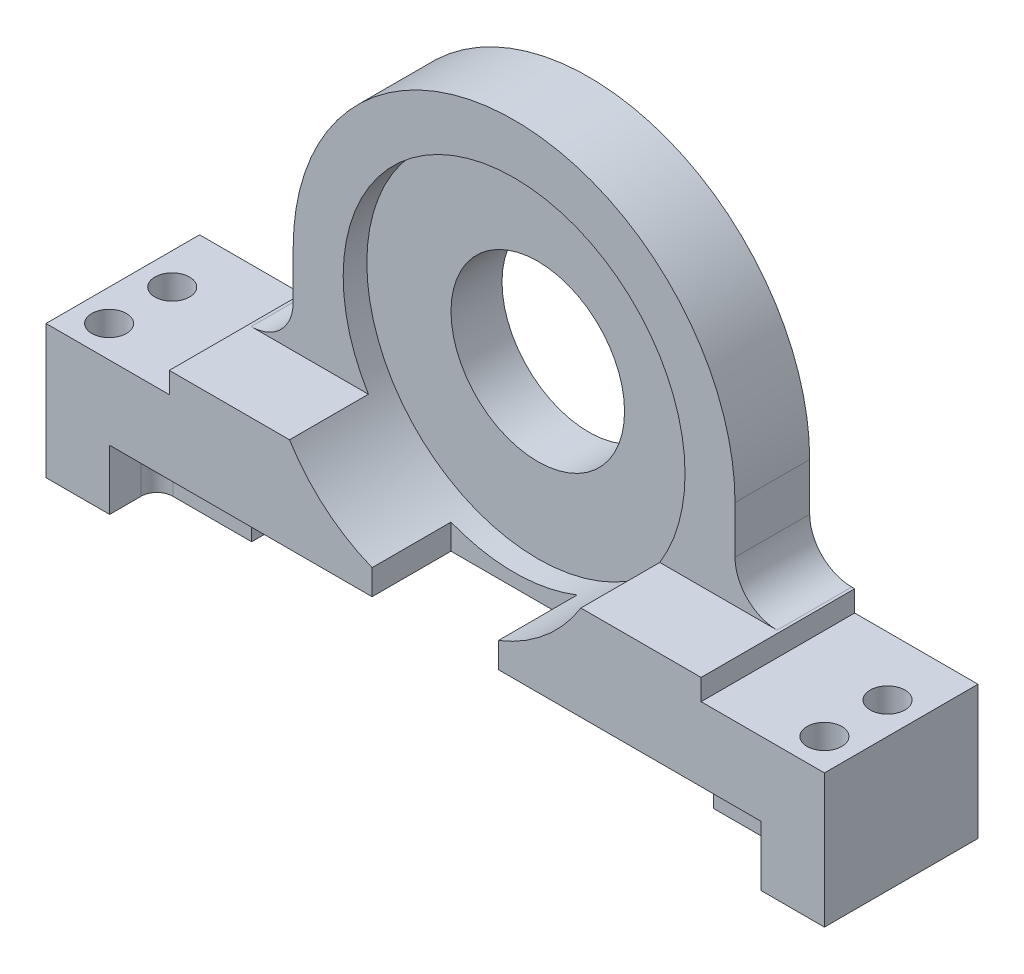
from build123d import *

# Parameters (mm, degrees)
SKETCH2_R           = 16
BOSS_EXTRUDE1_DEPTH = 12
SKETCH3_R           = 16
SKETCH3_R_2         = 8.25
BOSS_EXTRUDE2_DEPTH = 2.5
CUT_EXTRUDE4_DEPTH  = 1
CUT_EXTRUDE5_REACH  = 60.683
SKETCH9_W           = 43.9
SKETCH9_H           = 5.7
SKETCH10_R          = 1.65
CUT_EXTRUDE6_DEPTH  = 59.87817932
CUT_EXTRUDE7_START  = -7.5
CUT_EXTRUDE7_DEPTH  = 7.5
FILETE1_R           = 2
FILETE2_R           = 4
SKETCH12_W          = 9
SKETCH12_H          = 5.7
CUT_EXTRUDE8_DEPTH  = 4.5
SKETCH15_W          = 12
SKETCH15_H          = 2.667603026
CUT_EXTRUDE10_DEPTH = 7.5
SKETCH16_R          = 8.25
BOSS_EXTRUDE3_DEPTH = 2.6
FILLET2_R           = 1.5
CUT_EXTRUDE11_REACH = 61.463
SKETCH17_W          = 11.722279144
SKETCH17_H          = 2
CUT_EXTRUDE12_START = -2.25
SKETCH18_R          = 16.25
CUT_EXTRUDE12_DEPTH = 9.75


with BuildPart() as part:
    # Sketch2 → Boss-Extrude1 (new body)
    with BuildSketch(Plane.XY):
        with BuildLine():
            Line((-21, 0), (21, 0))
            Line((21, 0), (37, 0))
            Line((37, 0), (37, 14.7))
            Line((37, 14.7), (21, 14.7))
            Line((21, 14.7), (21, 23.2))
            ThreePointArc((21, 23.2), (0, 44.2), (-21, 23.2))
            Line((-21, 23.2), (-21, 14.7))
            Line((-21, 14.7), (-37, 14.7))
            Line((-37, 14.7), (-37, 0))
            Line((-37, 0), (-21, 0))
        make_face()
        with Locations((0, 23.2)):
            Circle(SKETCH2_R, mode=Mode.SUBTRACT)
    extrude(amount=BOSS_EXTRUDE1_DEPTH)

    # Sketch3 → Boss-Extrude2 (add)
    with BuildSketch(Plane.XY):
        with Locations((0, 23.2)):
            Circle(SKETCH3_R)
        with Locations((0, 23.2)):
            Circle(SKETCH3_R_2, mode=Mode.SUBTRACT)
    extrude(amount=BOSS_EXTRUDE2_DEPTH)

    # Sketch8 → Cut-Extrude4 (cut)
    with BuildSketch(Plane.XY):
        Polygon((-27.15, 0), (27.15, 0), (34.2, 0), (34.2, 7.35), (27.15, 7.35), (27.15, 10.7), (-27.15, 10.7), (-27.15, 7.35), (-34.2, 7.35), (-34.2, 0), align=None)
    extrude(amount=CUT_EXTRUDE4_DEPTH, mode=Mode.SUBTRACT)

    # Sketch9 → Cut-Extrude5 (cut, up to next)
    with BuildSketch(Plane(origin=(0, 0, 1), x_dir=(-1, 0, 0), z_dir=(0, 0, -1)), mode=Mode.PRIVATE) as cut_extrude5_sk1:
        with Locations((0, 2.85)):
            Rectangle(SKETCH9_W, SKETCH9_H)
    cut_extrude5_tool1 = extrude(cut_extrude5_sk1.sketch, amount=-CUT_EXTRUDE5_REACH, mode=Mode.PRIVATE) & part.part
    add(cut_extrude5_tool1.solids().sort_by_distance((0, 2.85, 1))[0], mode=Mode.SUBTRACT)

    # Sketch10 → Cut-Extrude6 (cut, through all)
    with BuildSketch(Plane.XZ):
        with Locations((-34, 9)):
            Circle(SKETCH10_R)
        with Locations((-34, 3)):
            Circle(SKETCH10_R)
        with Locations((34, 3)):
            Circle(SKETCH10_R)
        with Locations((34, 9)):
            Circle(SKETCH10_R)
    extrude(amount=-CUT_EXTRUDE6_DEPTH, mode=Mode.SUBTRACT)

    # Sketch11 → Cut-Extrude7 (cut)
    with BuildSketch(Plane.XY.offset(12).offset(CUT_EXTRUDE7_START)):
        with BuildLine():
            Line((21, 14.7), (21, 23.2))
            ThreePointArc((21, 23.2), (0, 44.2), (-21, 23.2))
            Line((-21, 23.2), (-21, 14.7))
            Line((-21, 14.7), (21, 14.7))
        make_face()
    extrude(amount=CUT_EXTRUDE7_DEPTH, mode=Mode.SUBTRACT)

    # Filete1
    filete1_edges = [part.edges().sort_by_distance(p)[0] for p in [
        (27.15, 10.7, 0.5),
        (-27.15, 10.7, 0.5),
    ]]
    fillet(filete1_edges, radius=FILETE1_R)

    # Filete2
    filete2_edges = [part.edges().sort_by_distance(p)[0] for p in [
        (-21, 14.7, 2.25),
        (21, 14.7, 2.25),
    ]]
    fillet(filete2_edges, radius=FILETE2_R)

    # Sketch12 → Cut-Extrude8 (cut)
    with BuildSketch(Plane.XY.offset(12)):
        with Locations((26.45, 2.85)):
            Rectangle(SKETCH12_W, SKETCH12_H)
        with Locations((-26.45, 2.85)):
            Rectangle(SKETCH12_W, SKETCH12_H)
    extrude(amount=-CUT_EXTRUDE8_DEPTH, mode=Mode.SUBTRACT)

    # Sketch15 → Cut-Extrude10 (cut)
    with BuildSketch(Plane.XY.offset(12)):
        with Locations((0, 7.033801513)):
            Rectangle(SKETCH15_W, SKETCH15_H)
    extrude(amount=-CUT_EXTRUDE10_DEPTH, mode=Mode.SUBTRACT)

    # Sketch16 → Boss-Extrude3 (add)
    with BuildSketch(Plane(origin=(0, 0, 0), x_dir=(-1, 0, 0), z_dir=(0, 0, -1))):
        with BuildLine():
            Line((-37, 14.7), (-25, 14.7))
            ThreePointArc((-25, 14.7), (-22.171572875, 15.871572875), (-21, 18.7))
            Line((-21, 18.7), (-21, 23.2))
            ThreePointArc((-21, 23.2), (0, 44.2), (21, 23.2))
            Line((21, 23.2), (21, 18.7))
            ThreePointArc((21, 18.7), (22.171572875, 15.871572875), (25, 14.7))
            Line((25, 14.7), (37, 14.7))
            Line((37, 14.7), (37, 0))
            Line((37, 0), (34.2, 0))
            Line((34.2, 0), (34.2, 7.35))
            Line((34.2, 7.35), (27.15, 7.35))
            Line((27.15, 7.35), (27.15, 8.7))
            ThreePointArc((27.15, 8.7), (26.564213562, 10.114213562), (25.15, 10.7))
            Line((25.15, 10.7), (-25.15, 10.7))
            ThreePointArc((-25.15, 10.7), (-26.564213562, 10.114213562), (-27.15, 8.7))
            Line((-27.15, 8.7), (-27.15, 7.35))
            Line((-27.15, 7.35), (-34.2, 7.35))
            Line((-34.2, 7.35), (-34.2, 0))
            Line((-34.2, 0), (-37, 0))
            Line((-37, 0), (-37, 14.7))
        make_face()
        with Locations((0, 23.2)):
            Circle(SKETCH16_R, mode=Mode.SUBTRACT)
    extrude(amount=BOSS_EXTRUDE3_DEPTH)

    # Fillet2
    fillet2_edges = [part.edges().sort_by_distance(p)[0] for p in [
        (30.95, 2.85, 7.5),
        (-30.95, 2.85, 7.5),
    ]]
    fillet(fillet2_edges, radius=FILLET2_R)

    # Sketch17 → Cut-Extrude11 (cut, up to next)
    with BuildSketch(Plane.XY.offset(12), mode=Mode.PRIVATE) as cut_extrude11_sk1:
        with Locations((-31.138860428, 13.7)):
            Rectangle(SKETCH17_W, SKETCH17_H)
    cut_extrude11_tool1 = extrude(cut_extrude11_sk1.sketch, amount=-CUT_EXTRUDE11_REACH, mode=Mode.PRIVATE) & part.part
    # Sketch17 → Cut-Extrude11 (cut, up to next)
    with BuildSketch(Plane.XY.offset(12), mode=Mode.PRIVATE) as cut_extrude11_sk2:
        with Locations((31.138860428, 13.7)):
            Rectangle(SKETCH17_W, SKETCH17_H)
    cut_extrude11_tool2 = extrude(cut_extrude11_sk2.sketch, amount=-CUT_EXTRUDE11_REACH, mode=Mode.PRIVATE) & part.part
    add(cut_extrude11_tool1.solids().sort_by_distance((-31.13886, 13.7, 12))[0], mode=Mode.SUBTRACT)
    add(cut_extrude11_tool2.solids().sort_by_distance((31.13886, 13.7, 12))[0], mode=Mode.SUBTRACT)

    # Sketch18 → Cut-Extrude12 (cut)
    with BuildSketch(Plane.XY.offset(4.5).offset(CUT_EXTRUDE12_START)):
        with Locations((0, 23.2)):
            Circle(SKETCH18_R)
    extrude(amount=CUT_EXTRUDE12_DEPTH, mode=Mode.SUBTRACT)


solid = part.part
